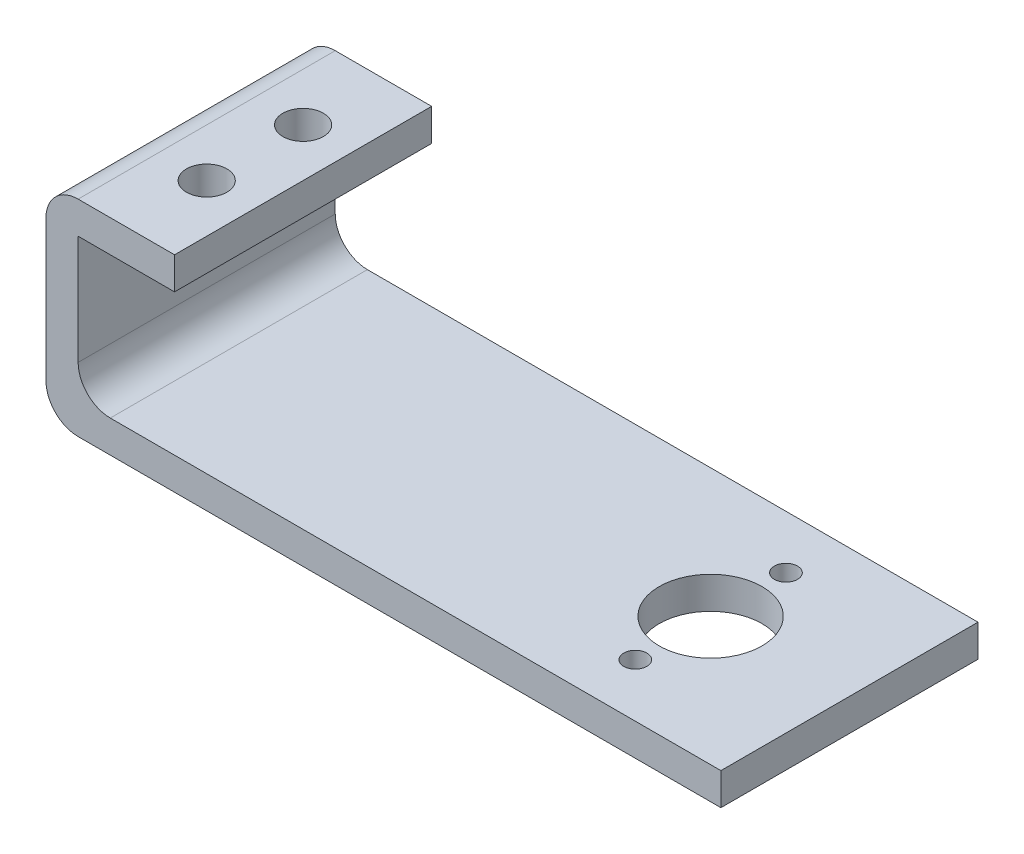
from build123d import *

# Parameters (mm, degrees)
BOSS_EXTRUDE1_DEPTH       = 25.4
F_4_0MM_DOWEL_HOLE1_D     = 4
F_4_0MM_DOWEL_HOLE1_DEPTH = 3.175
CUT_EXTRUDE1_REACH        = 51.202
SKETCH7_R                 = 5.08
SKETCH7_R_2               = 1.143
FILLET1_R                 = 3.175


with BuildPart() as part:
    # Sketch1 → Boss-Extrude1 (new body)
    with BuildSketch(Plane.XY):
        Polygon((-17.059275079, -16.268900152), (-29.759275079, -16.268900152), (-29.759275079, -36.588900152), (36.915724921, -36.588900152), (36.915724921, -33.413900152), (-26.584275079, -33.413900152), (-26.584275079, -19.443900152), (-17.059275079, -19.443900152), align=None)
    extrude(amount=BOSS_EXTRUDE1_DEPTH)

    # Ø4.0mm Dowel Hole1
    with Locations(Plane(origin=(0, -16.268900152, 0), x_dir=(1, 0, 0), z_dir=(0, 1, 0))):
        with Locations((-21.821775079, -7.9375), (-21.821775079, -17.4625)):
            Hole(F_4_0MM_DOWEL_HOLE1_D / 2, depth=F_4_0MM_DOWEL_HOLE1_DEPTH)

    # Sketch7 → Cut-Extrude1 (cut, up to next)
    with BuildSketch(Plane.XZ.offset(36.588900152), mode=Mode.PRIVATE) as cut_extrude1_sk1:
        with Locations(Location((23.199724921, 12.7, 0), (0, 0, 270))):
            Circle(SKETCH7_R)
    cut_extrude1_tool1 = extrude(cut_extrude1_sk1.sketch, amount=-CUT_EXTRUDE1_REACH, mode=Mode.PRIVATE) & part.part
    # Sketch7 → Cut-Extrude1 (cut, up to next)
    with BuildSketch(Plane.XZ.offset(36.588900152), mode=Mode.PRIVATE) as cut_extrude1_sk2:
        with Locations(Location((23.199724921, 5.2578, 0), (0, 0, 270))):
            Circle(SKETCH7_R_2)
    cut_extrude1_tool2 = extrude(cut_extrude1_sk2.sketch, amount=-CUT_EXTRUDE1_REACH, mode=Mode.PRIVATE) & part.part
    # Sketch7 → Cut-Extrude1 (cut, up to next)
    with BuildSketch(Plane.XZ.offset(36.588900152), mode=Mode.PRIVATE) as cut_extrude1_sk3:
        with Locations(Location((23.199724921, 20.1422, 0), (0, 0, 270))):
            Circle(SKETCH7_R_2)
    cut_extrude1_tool3 = extrude(cut_extrude1_sk3.sketch, amount=-CUT_EXTRUDE1_REACH, mode=Mode.PRIVATE) & part.part
    add(cut_extrude1_tool1.solids().sort_by_distance((23.199725, -36.5889, 12.7))[0], mode=Mode.SUBTRACT)
    add(cut_extrude1_tool2.solids().sort_by_distance((23.199725, -36.5889, 5.2578))[0], mode=Mode.SUBTRACT)
    add(cut_extrude1_tool3.solids().sort_by_distance((23.199725, -36.5889, 20.1422))[0], mode=Mode.SUBTRACT)

    # Fillet1
    fillet1_edges = [part.edges().sort_by_distance(p)[0] for p in [
        (-26.584275079, -33.413900152, 12.7),
        (-29.759275079, -36.588900152, 12.7),
        (-29.759275079, -16.268900152, 12.7),
    ]]
    fillet(fillet1_edges, radius=FILLET1_R)


solid = part.part
